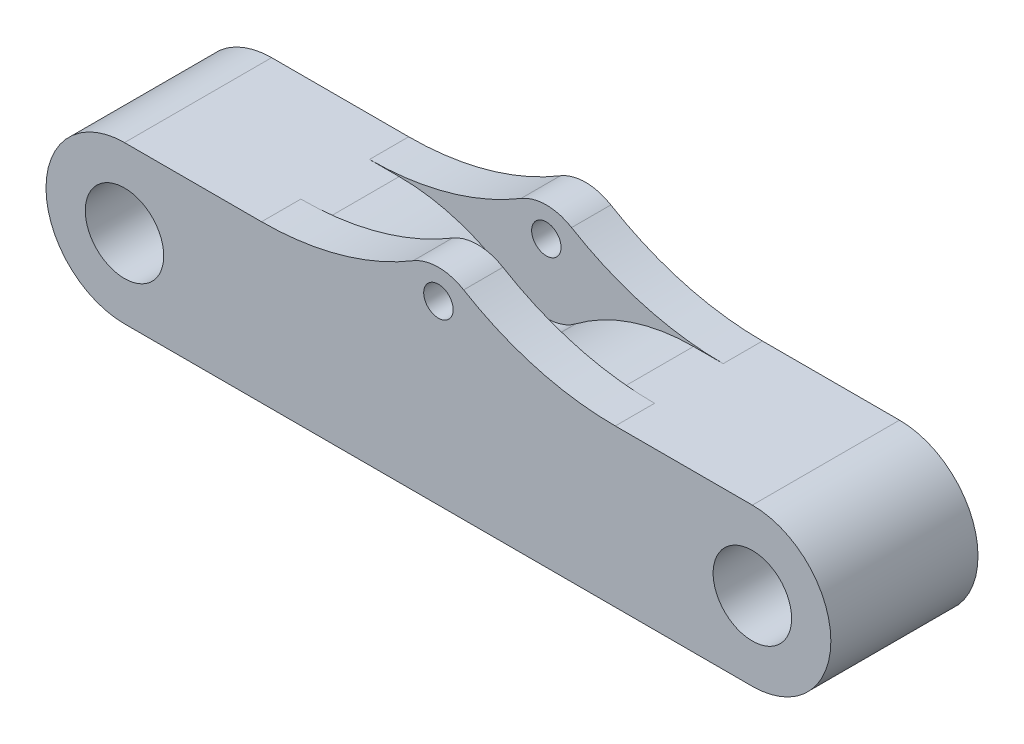
from build123d import *

# Parameters (mm, degrees)
SKETCH1_R           = 1.5
SKETCH1_R_2         = 4
BOSS_EXTRUDE1_DEPTH = 15
CUT_EXTRUDE1_START  = -11
CUT_EXTRUDE1_DEPTH  = 7


with BuildPart() as part:
    # Sketch1 → Boss-Extrude1 (new body)
    with BuildSketch(Plane.XY):
        with BuildLine():
            Line((-32, 0), (32, 0))
            ThreePointArc((32, 0), (40, 8), (32, 16))
            Line((32, 16), (18.027756377, 16))
            ThreePointArc((18.027756377, 16), (10.00991912, 17.09127665), (2.575393768, 20.285714286))
            ThreePointArc((2.575393768, 20.285714286), (0, 21), (-2.575393768, 20.285714286))
            ThreePointArc((-2.575393768, 20.285714286), (-10.00991912, 17.09127665), (-18.027756377, 16))
            Line((-18.027756377, 16), (-32, 16))
            ThreePointArc((-32, 16), (-40, 8), (-32, 0))
        make_face()
        with Locations((0, 18)):
            Circle(SKETCH1_R, mode=Mode.SUBTRACT)
        with Locations((-32, 8)):
            Circle(SKETCH1_R_2, mode=Mode.SUBTRACT)
        with Locations((32, 8)):
            Circle(SKETCH1_R_2, mode=Mode.SUBTRACT)
    extrude(amount=BOSS_EXTRUDE1_DEPTH)

    # Sketch2 → Cut-Extrude1 (cut)
    with BuildSketch(Plane.XY.offset(15).offset(CUT_EXTRUDE1_START)):
        with BuildLine():
            Line((-18.027756377, 16), (-15, 16))
            ThreePointArc((-15, 16), (-8.67544468, 14.973665961), (-3, 12))
            ThreePointArc((-3, 12), (0, 11), (3, 12))
            ThreePointArc((3, 12), (8.67544468, 14.973665961), (15, 16))
            Line((15, 16), (18.027756377, 16))
            Line((18.027756377, 16), (18.027756377, 21))
            Line((18.027756377, 21), (-18.027756377, 21))
            Line((-18.027756377, 21), (-18.027756377, 16))
        make_face()
    extrude(amount=CUT_EXTRUDE1_DEPTH, mode=Mode.SUBTRACT)


solid = part.part
